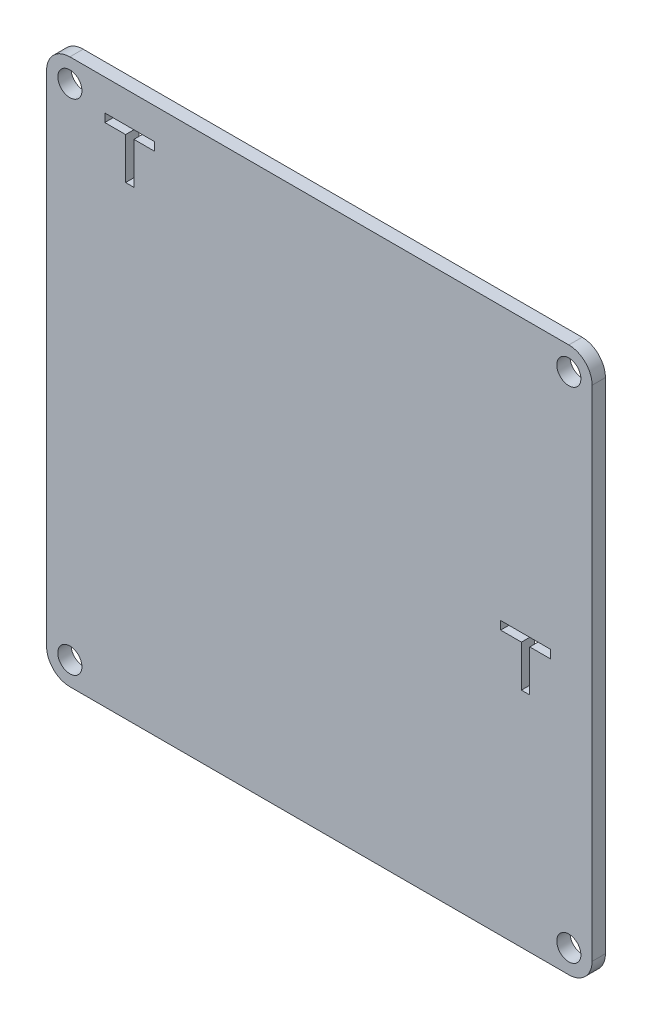
from build123d import *

# Parameters (mm, degrees)
SKETCH_1_R          = 1.45
EXTRUDE_1_DEPTH     = 1.6
CUT_EXTRUDE_1_DEPTH = 1.6
CUT_EXTRUDE_2_DEPTH = 1.6


with BuildPart() as part:
    # 草图1 → 凸台-拉伸1 (new body)
    with BuildSketch(Plane.XY):
        with BuildLine():
            Line((-30, 32.8), (30, 32.8))
            ThreePointArc((30, 32.8), (31.979898987, 31.979898987), (32.8, 30))
            Line((32.8, 30), (32.8, -30))
            ThreePointArc((32.8, -30), (31.979898987, -31.979898987), (30, -32.8))
            Line((30, -32.8), (-30, -32.8))
            ThreePointArc((-30, -32.8), (-31.979898987, -31.979898987), (-32.8, -30))
            Line((-32.8, -30), (-32.8, 30))
            ThreePointArc((-32.8, 30), (-31.979898987, 31.979898987), (-30, 32.8))
        make_face()
        with Locations((-30, 30)):
            Circle(SKETCH_1_R, mode=Mode.SUBTRACT)
        with Locations((30, 30)):
            Circle(SKETCH_1_R, mode=Mode.SUBTRACT)
        with Locations((-30, -30)):
            Circle(SKETCH_1_R, mode=Mode.SUBTRACT)
        with Locations((30, -30)):
            Circle(SKETCH_1_R, mode=Mode.SUBTRACT)
    extrude(amount=EXTRUDE_1_DEPTH)

    # 草图2 → 切除-拉伸1 (cut)
    with BuildSketch(Plane.XY.offset(1.6)):
        Polygon((-25.8, 29.06), (-19.8, 29.06), (-19.8, 28.06), (-22.3, 28.06), (-22.3, 23.06), (-23.3, 23.06), (-23.3, 28.06), (-25.8, 28.06), align=None)
    extrude(amount=-CUT_EXTRUDE_1_DEPTH, mode=Mode.SUBTRACT)

    # 草图3 → 切除-拉伸2 (cut)
    with BuildSketch(Plane.XY.offset(1.6)):
        Polygon((25.3, -1), (27.8, -1), (27.8, 0), (21.8, 0), (21.8, -1), (24.3, -1), (24.3, -6), (25.3, -6), align=None)
    extrude(amount=-CUT_EXTRUDE_2_DEPTH, mode=Mode.SUBTRACT)


solid = part.part
